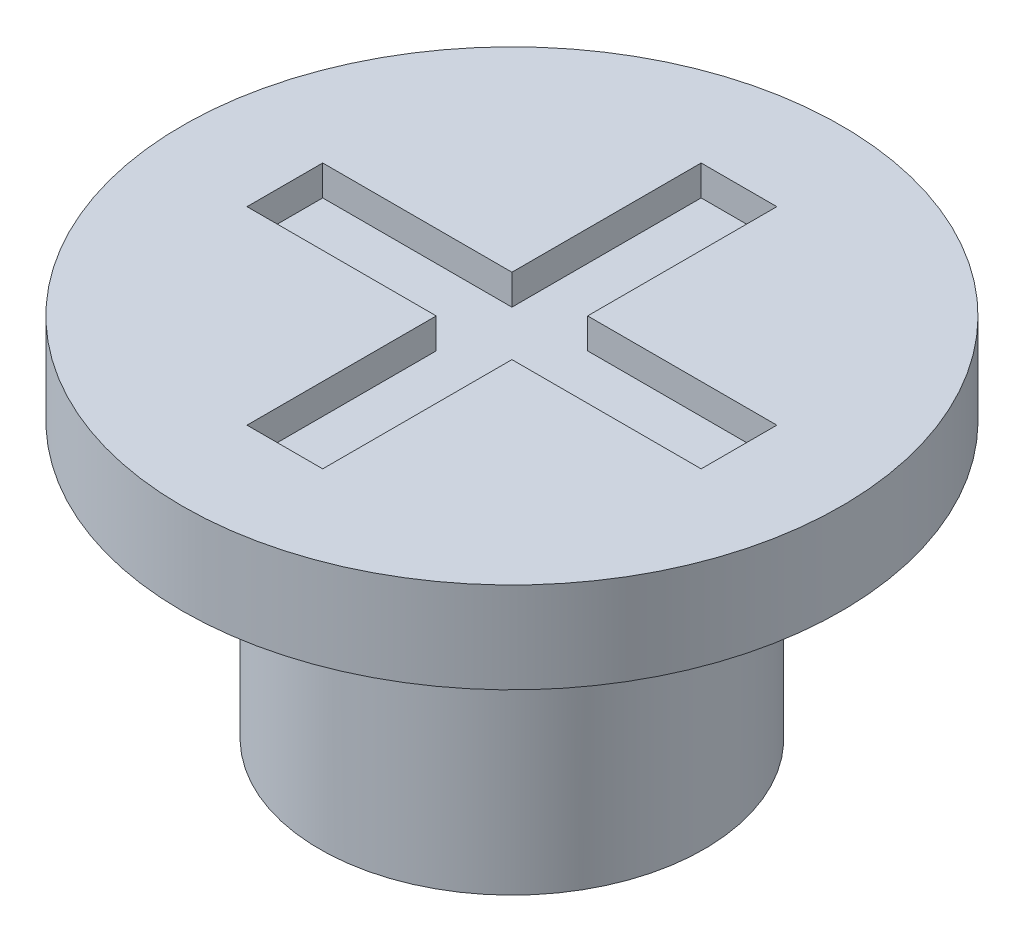
from build123d import *

# Parameters (mm, degrees)
SKETCH1_R           = 3.175
BOSS_EXTRUDE1_DEPTH = 21.54
SKETCH2_R           = 5.442868
BOSS_EXTRUDE2_DEPTH = 1.5
SKETCH3_W           = 1.25
SKETCH3_H           = 3.125
SKETCH3_W_2         = 3.125
SKETCH3_H_2         = 1.25
CUT_EXTRUDE2_DEPTH  = 0.5
SKETCH4_R           = 3.175
CUT_EXTRUDE3_DEPTH  = 17


with BuildPart() as part:
    # Sketch1 → Boss-Extrude1 (new body)
    with BuildSketch(Plane(origin=(0, 0, 0), x_dir=(1, 0, 0), z_dir=(0, 1, 0))):
        with Locations(Location((0, 0, 0), (0, 0, 270))):
            Circle(SKETCH1_R)
    extrude(amount=BOSS_EXTRUDE1_DEPTH)

    # Sketch2 → Boss-Extrude2 (add)
    with BuildSketch(Plane(origin=(0, 21.54, 0), x_dir=(1, 0, 0), z_dir=(0, 1, 0))):
        with Locations(Location((0, 0, 0), (0, 0, 270))):
            Circle(SKETCH2_R)
    extrude(amount=BOSS_EXTRUDE2_DEPTH)

    # Sketch3 → Cut-Extrude2 (cut)
    with BuildSketch(Plane(origin=(0, 23.04, 0), x_dir=(1, 0, 0), z_dir=(0, 1, 0))):
        with Locations((0, -2.1875)):
            Rectangle(SKETCH3_W, SKETCH3_H)
        with Locations((-2.1875, 0)):
            Rectangle(SKETCH3_W_2, SKETCH3_H_2)
        with Locations((0, 2.1875)):
            Rectangle(SKETCH3_W, SKETCH3_H)
        with Locations((2.1875, 0)):
            Rectangle(SKETCH3_W_2, SKETCH3_H_2)
        Rectangle(SKETCH3_W, SKETCH3_H_2)
    extrude(amount=-CUT_EXTRUDE2_DEPTH, mode=Mode.SUBTRACT)

    # Sketch4 → Cut-Extrude3 (cut)
    with BuildSketch(Plane.XZ):
        with Locations(Location((0, 0, 0), (0, 0, 270))):
            Circle(SKETCH4_R)
    extrude(amount=-CUT_EXTRUDE3_DEPTH, mode=Mode.SUBTRACT)


solid = part.part
